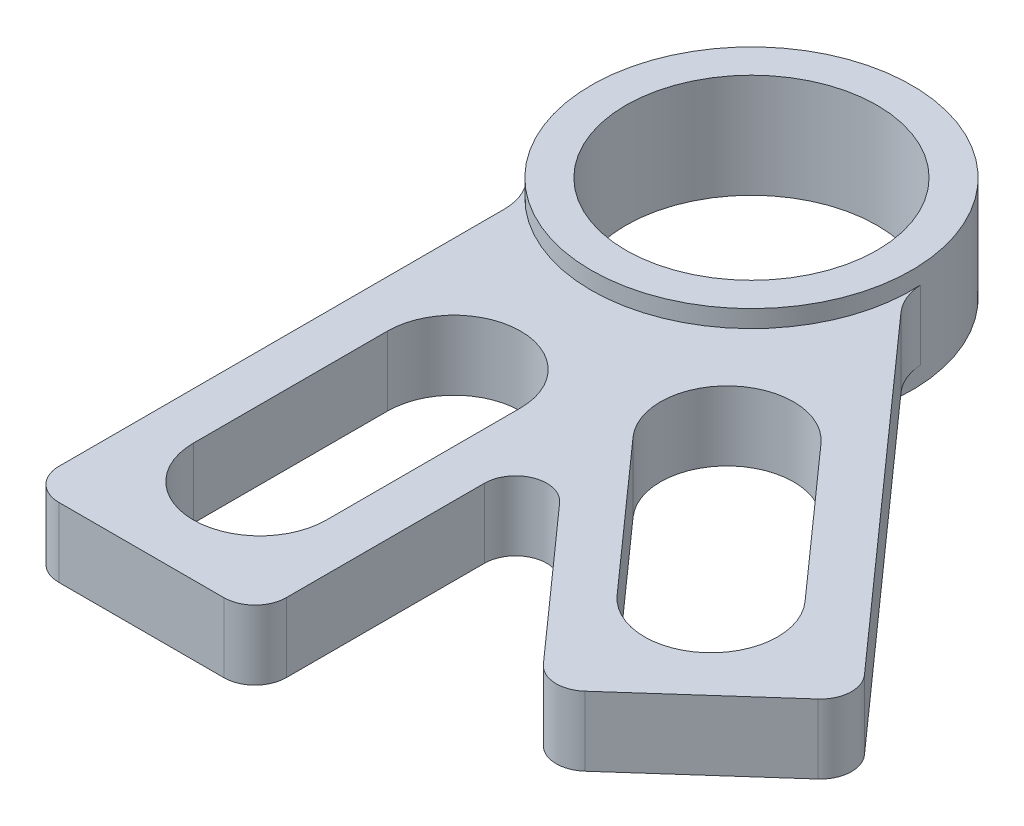
from build123d import *

# Parameters (mm, degrees)
SKETCH1_R                      = 14.6812
SKETCH1_R_2                    = 11.5062
BEARING_INSERT_EXTRUDE_DEPTH   = 4.7625
APEX_SLOT_INSERT_EXTRUDE_DEPTH = 3.175
FILLET1_R                      = 5.08
FILLET2_R                      = 2.8575


with BuildPart() as part:
    # Sketch1 → Bearing_Insert_Extrude (new, symmetric)
    with BuildSketch(Plane(origin=(0, 0, 0), x_dir=(1, 0, 0), z_dir=(0, 1, 0))):
        with Locations(Location((0, 0, 0), (0, 0, 90))):
            Circle(SKETCH1_R)
        with Locations(Location((0, 0, 0), (0, 0, 90))):
            Circle(SKETCH1_R_2, mode=Mode.SUBTRACT)
    extrude(amount=BEARING_INSERT_EXTRUDE_DEPTH, both=True)

    # Sketch1<4> → Apex_Slot_Insert_Extrude (add, symmetric)
    with BuildSketch(Plane(origin=(0, 0, 0), x_dir=(1, 0, 0), z_dir=(0, 1, 0))):
        with BuildLine():
            Line((-10.414, -10.348248037), (-10.414, -55.88))
            Line((-10.414, -55.88), (10.414, -55.88))
            Line((10.414, -55.88), (10.414, -27.365061948))
            Line((10.414, -27.365061948), (29.371655227, -48.665507962))
            Line((29.371655227, -48.665507962), (44.930015858, -34.818378351))
            Line((44.930015858, -34.818378351), (14.659031085, -0.806499284))
            ThreePointArc((14.659031085, -0.806499284), (5.221715671, -13.721199616), (-10.414, -10.348248037))
        make_face()
        with BuildLine():
            ThreePointArc((6.096, -45.0215), (0, -51.1175), (-6.096, -45.0215))
            Line((-6.096, -45.0215), (-6.096, -27.2415))
            ThreePointArc((-6.096, -27.2415), (0, -21.1455), (6.096, -27.2415))
            Line((6.096, -27.2415), (6.096, -45.0215))
        make_face(mode=Mode.SUBTRACT)
        with BuildLine():
            ThreePointArc((34.485419253, -29.577906234), (33.98457115, -38.184391183), (25.378086201, -37.68354308))
            Line((25.378086201, -37.68354308), (13.557365801, -24.402015712))
            ThreePointArc((13.557365801, -24.402015712), (14.058213904, -15.795530763), (22.664698853, -16.296378866))
            Line((22.664698853, -16.296378866), (34.485419253, -29.577906234))
        make_face(mode=Mode.SUBTRACT)
    extrude(amount=APEX_SLOT_INSERT_EXTRUDE_DEPTH, both=True)

    # Fillet1
    fillet1_edges = [part.edges().sort_by_distance(p)[0] for p in [
        (14.659031085, 0, 0.806499284),
        (-10.414, 0, 10.348248037),
    ]]
    fillet(fillet1_edges, radius=FILLET1_R)

    # Fillet2
    fillet2_edges = [part.edges().sort_by_distance(p)[0] for p in [
        (-10.414, 0, 55.88),
        (10.414, 0, 55.88),
        (10.414, 0, 27.365061948),
        (29.371655227, 0, 48.665507962),
        (44.930015858, 0, 34.818378351),
    ]]
    fillet(fillet2_edges, radius=FILLET2_R)


solid = part.part
